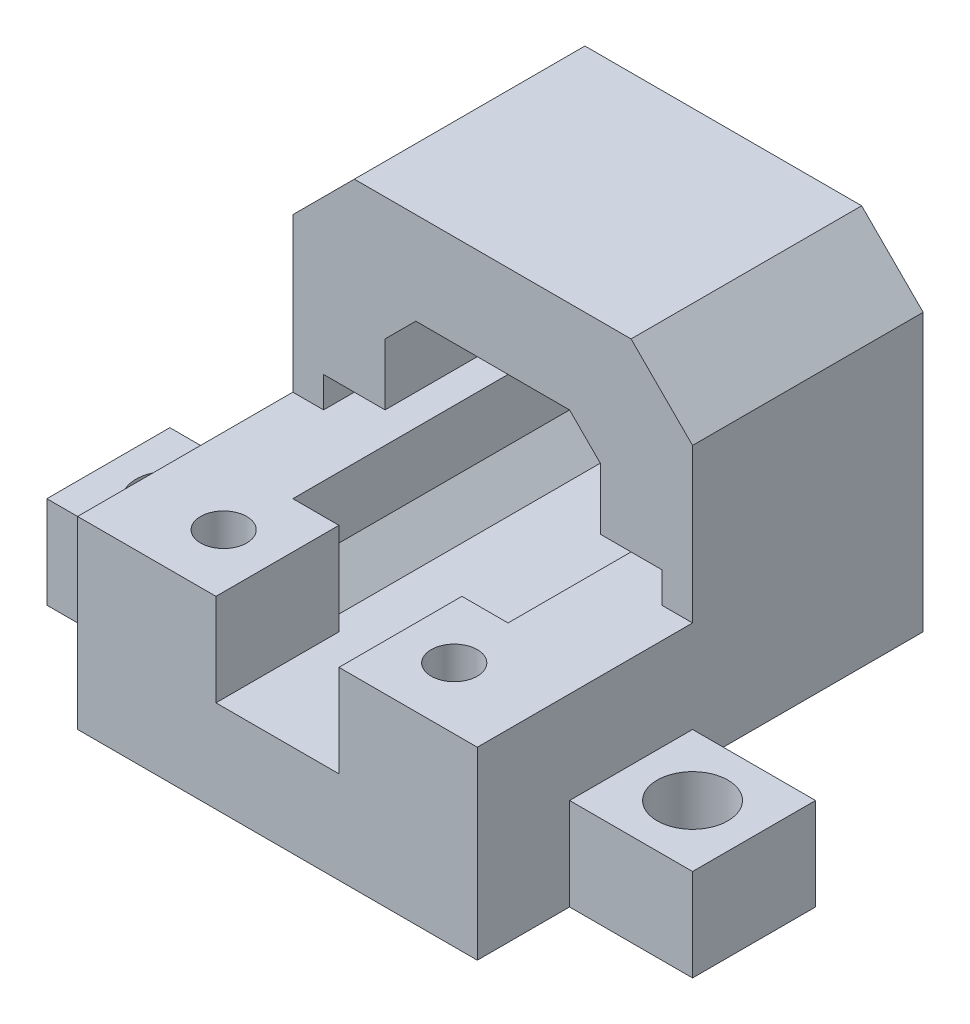
from build123d import *

# Parameters (mm, degrees)
BOSS_EXTRU_1_DEPTH      = 15
BOSS_EXTRU_2_DEPTH      = 14
ESQUISSE3_W             = 4
ESQUISSE3_H             = 2
ENL_V_MAT_EXTRU_1_DEPTH = 10
BOSS_EXTRU_3_DEPTH      = 8
ESQUISSE6_R             = 1.5
ENL_V_MAT_EXTRU_2_DEPTH = 10
BOSS_EXTRU_4_DEPTH      = 14
ESQUISSE9_W             = 8
ESQUISSE9_H             = 8
ESQUISSE9_R             = 2.2
ESQUISSE9_R_2           = 2.3
BOSS_EXTRU_5_DEPTH      = 6


with BuildPart() as part:
    # Esquisse1 → Boss.-Extru.1 (new body)
    with BuildSketch(Plane.XY):
        Polygon((13, 0), (13, -9), (9, -13), (-9, -13), (-13, -9), (-13, 0), (-13, 9), (-9, 13), (0, 13), (9, 13), (13, 9), align=None)
        Polygon((7, 0), (7, -5), (5, -7), (-5, -7), (-7, -5), (-7, 0), (-7, 5), (-5, 7), (5, 7), (7, 5), align=None, mode=Mode.SUBTRACT)
    extrude(amount=BOSS_EXTRU_1_DEPTH)

    # Esquisse2 → Boss.-Extru.2 (add)
    with BuildSketch(Plane.XY.offset(15)):
        Polygon((-9, -13), (9, -13), (13, -9), (13, -1), (7, -1), (7, -5), (5, -7), (-5, -7), (-7, -5), (-7, -1), (-13, -1), (-13, -9), align=None)
    extrude(amount=BOSS_EXTRU_2_DEPTH)

    # Esquisse3 → Enlèv. mat.-Extru.1 (cut)
    with BuildSketch(Plane.XY.offset(15)):
        with Locations((-9, 0)):
            Rectangle(ESQUISSE3_W, ESQUISSE3_H)
        with Locations((9, 0)):
            Rectangle(ESQUISSE3_W, ESQUISSE3_H)
    extrude(amount=-ENL_V_MAT_EXTRU_1_DEPTH, mode=Mode.SUBTRACT)

    # Esquisse5 → Boss.-Extru.3 (add)
    with BuildSketch(Plane.XY.offset(29)):
        Polygon((-4, -1), (-7, -1), (-7, -5), (-5, -7), (-4, -7), align=None)
        Polygon((5, -7), (7, -5), (7, -1), (4, -1), (4, -7), align=None)
    extrude(amount=-BOSS_EXTRU_3_DEPTH)

    # Esquisse6 → Enlèv. mat.-Extru.2 (cut)
    with BuildSketch(Plane(origin=(0, -1, 0), x_dir=(1, 0, 0), z_dir=(0, 1, 0))):
        with Locations(Location((-7.5, -25, 0), (0, 0, 180))):
            Circle(ESQUISSE6_R)
        with Locations(Location((7.5, -25, 0), (0, 0, 180))):
            Circle(ESQUISSE6_R)
    extrude(amount=-ENL_V_MAT_EXTRU_2_DEPTH, mode=Mode.SUBTRACT)

    # Esquisse8 → Boss.-Extru.4 (add)
    with BuildSketch(Plane.XY.offset(29)):
        Polygon((-13, -9), (-9, -13), (-13, -13), align=None)
        Polygon((9, -13), (13, -13), (13, -9), align=None)
    extrude(amount=-BOSS_EXTRU_4_DEPTH)

    # Esquisse9 → Boss.-Extru.5 (add)
    # profile 1 of 2: a face of its own
    with BuildSketch(Plane.XZ.offset(13)):
        with Locations((-17, 19)):
            Rectangle(ESQUISSE9_W, ESQUISSE9_H)
        with Locations((-17, 19)):
            Circle(ESQUISSE9_R, mode=Mode.SUBTRACT)
    # profile 2 of 2: a face of its own
    with BuildSketch(Plane.XZ.offset(13)):
        with Locations((17, 19)):
            Rectangle(ESQUISSE9_W, ESQUISSE9_H)
        with Locations((17, 19)):
            Circle(ESQUISSE9_R_2, mode=Mode.SUBTRACT)
    extrude(amount=-BOSS_EXTRU_5_DEPTH)


solid = part.part
